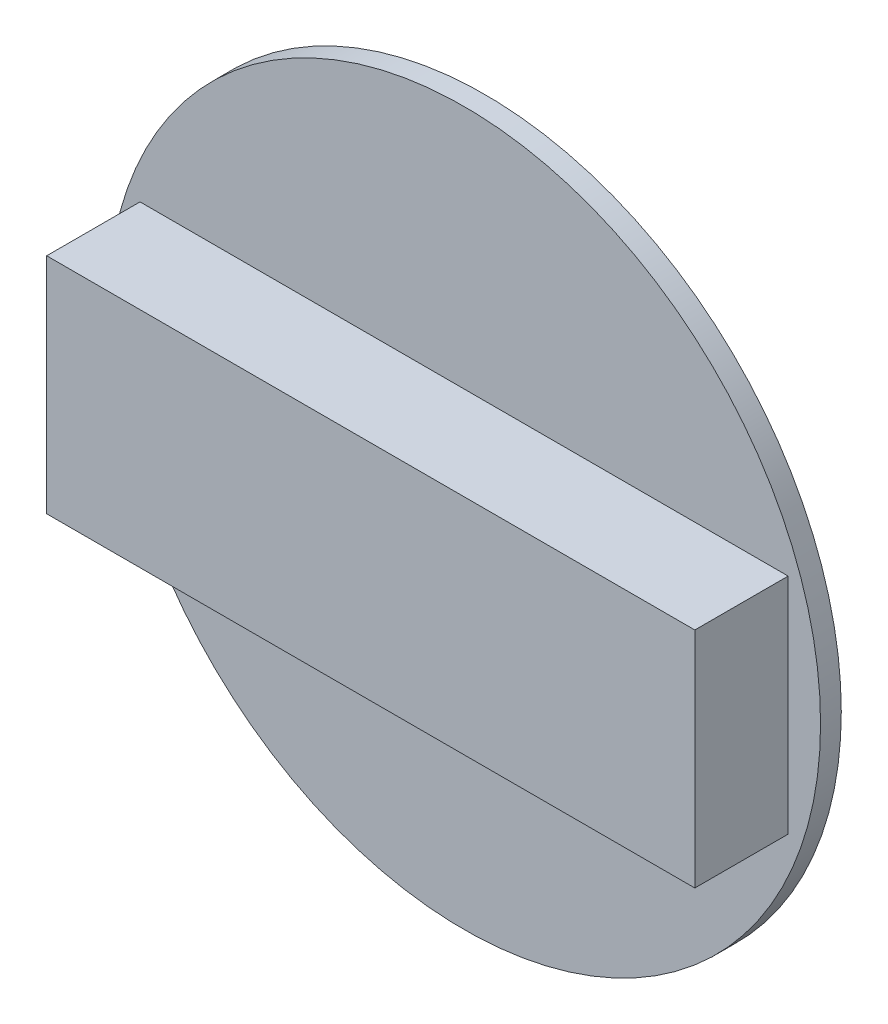
from build123d import *

# Parameters (mm, degrees)
SKETCH_1_R          = 27.5
EXTRUDE_1_DEPTH     = 1.6
SKETCH_2_W          = 50
SKETCH_2_H          = 17.24
EXTRUDE_2_DEPTH     = 7.2
CUT_EXTRUDE_1_DEPTH = 40.551738268


with BuildPart() as part:
    # 草图1 → 凸台-拉伸1 (new body)
    with BuildSketch(Plane.XY):
        Circle(SKETCH_1_R)
    extrude(amount=EXTRUDE_1_DEPTH)

    # 草图2 → 凸台-拉伸2 (add)
    with BuildSketch(Plane.XY.offset(1.6)):
        Rectangle(SKETCH_2_W, SKETCH_2_H)
    extrude(amount=EXTRUDE_2_DEPTH)

    # 草图3 → 切除-拉伸1 (cut, through all)
    with BuildSketch(Plane.XY.offset(1.6)):
        with BuildLine():
            Line((-27.443123, 1.767766953), (-26.382462828, 0.707106781))
            ThreePointArc((-26.382462828, 0.707106781), (-26.08956961, 0), (-26.382462828, -0.707106781))
            Line((-26.382462828, -0.707106781), (-27.443123, -1.767766953))
            ThreePointArc((-27.443123, -1.767766953), (-27.5, 0), (-27.443123, 1.767766953))
        make_face()
    extrude(amount=-CUT_EXTRUDE_1_DEPTH, mode=Mode.SUBTRACT)


solid = part.part
